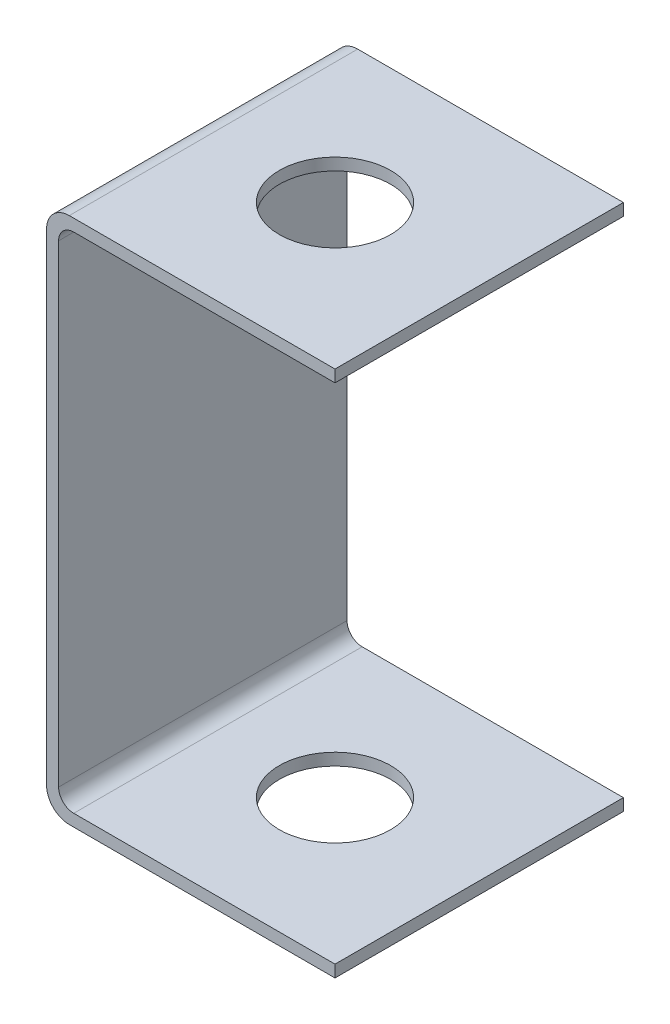
from build123d import *

# Parameters (mm, degrees)
BOSS_EXTRUDE1_DEPTH = 38.1
SKETCH3_R           = 7.35
CUT_EXTRUDE1_DEPTH  = 82.664668768
FILLET1_R           = 2
FILLET2_R           = 3


with BuildPart() as part:
    # Sketch1 → Boss-Extrude1 (new body)
    with BuildSketch(Plane.XY):
        Polygon((-17.4625, 68.0875), (19.05, 68.0875), (19.05, 69.675), (-19.05, 69.675), (-19.05, 0), (19.05, 0), (19.05, 1.5875), (-17.4625, 1.5875), align=None)
    extrude(amount=BOSS_EXTRUDE1_DEPTH)

    # Sketch3 → Cut-Extrude1 (cut, through all)
    with BuildSketch(Plane(origin=(0, 0, 0), x_dir=(1, 0, 0), z_dir=(0, 1, 0))):
        with Locations((0, -19.05)):
            Circle(SKETCH3_R)
    extrude(amount=CUT_EXTRUDE1_DEPTH, mode=Mode.SUBTRACT)

    # Fillet1
    fillet1_edges = [part.edges().sort_by_distance(p)[0] for p in [
        (-17.4625, 1.5875, 19.05),
        (-17.4625, 68.0875, 19.05),
    ]]
    fillet(fillet1_edges, radius=FILLET1_R)

    # Fillet2
    fillet2_edges = [part.edges().sort_by_distance(p)[0] for p in [
        (-19.05, 0, 19.05),
        (-19.05, 69.675, 19.05),
    ]]
    fillet(fillet2_edges, radius=FILLET2_R)


solid = part.part
